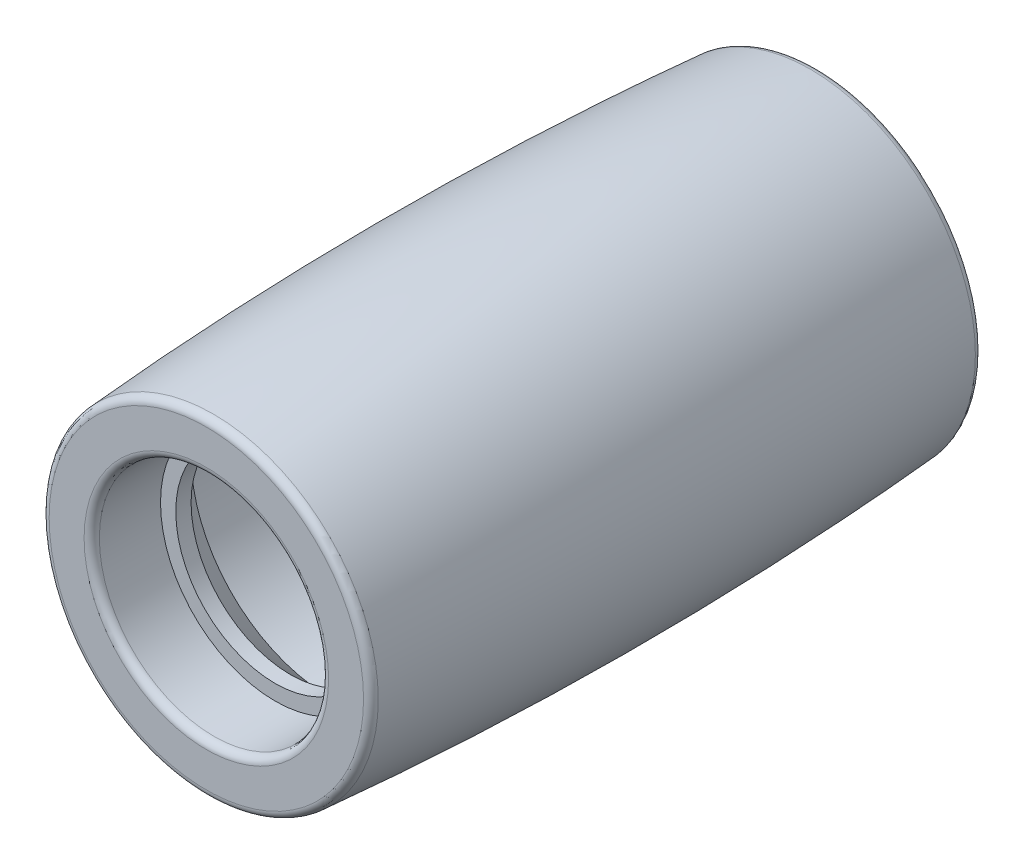
from build123d import *

# Parameters (mm, degrees)
KREISMUSTER2_COUNT = 4
VERRUNDUNG1_R      = 1


with BuildPart() as part:
    # Skizze1 → Rotation1 (revolve)
    with BuildSketch(Plane(origin=(0, 0, 0), x_dir=(0, 0, -1), z_dir=(1, 0, 0)), mode=Mode.PRIVATE) as rotation1_sk:
        with BuildLine():
            Line((89.5, 21.5), (89.5, 19.25))
            Line((89.5, 19.25), (83.144506921, 19.25))
            Line((83.144506921, 19.25), (81, 18.25))
            Line((81, 18.25), (42.3, 18.25))
            Line((42.3, 18.25), (42.3, 11))
            Line((42.3, 11), (39.3, 11))
            Line((39.3, 11), (39.3, 18.25))
            Line((39.3, 18.25), (25.75, 18.25))
            Line((25.75, 18.25), (20.5, 13))
            Line((20.5, 13), (18.5, 13))
            Line((18.5, 13), (18.5, 15))
            Line((18.5, 15), (9.5, 15))
            Line((9.5, 15), (9.5, 21.5))
            ThreePointArc((9.5, 21.5), (49.5, 23), (89.5, 21.5))
        make_face()
    revolve(rotation1_sk.sketch.rotate(Axis((0, 0, 0), (0, 0, -1)), 90), axis=Axis((0, 0, 0), (0, 0, -1)))

    # Skizze5 → Durchgangsloch für M31 (revolve, cut)
    with BuildSketch(Plane(origin=(0, 14, -39.3), x_dir=(0, -1, 0), z_dir=(1, 0, 0))):
        Polygon((0, 0), (0, 10.581549114), (1.8, 9.5), (1.8, 0), align=None)
    durchgangsloch_f_r_m31 = revolve(axis=Axis((0, 14, -32.95), (0, 0, -1)), mode=Mode.SUBTRACT)

    # Kreismuster2: Durchgangsloch für M31 ×4 about axis
    kreismuster2_axis = Axis((0, 0, 0), (0, 0, 1))
    for i in range(1, KREISMUSTER2_COUNT):
        add(durchgangsloch_f_r_m31.rotate(kreismuster2_axis, i * 360 / KREISMUSTER2_COUNT), mode=Mode.SUBTRACT)

    # Verrundung1
    verrundung1_edges = [part.edges().sort_by_distance(p)[0] for p in [
        (-21.5, 0, -89.5),
        (-15, 0, -9.5),
        (-21.5, 0, -9.5),
    ]]
    fillet(verrundung1_edges, radius=VERRUNDUNG1_R)


solid = part.part
